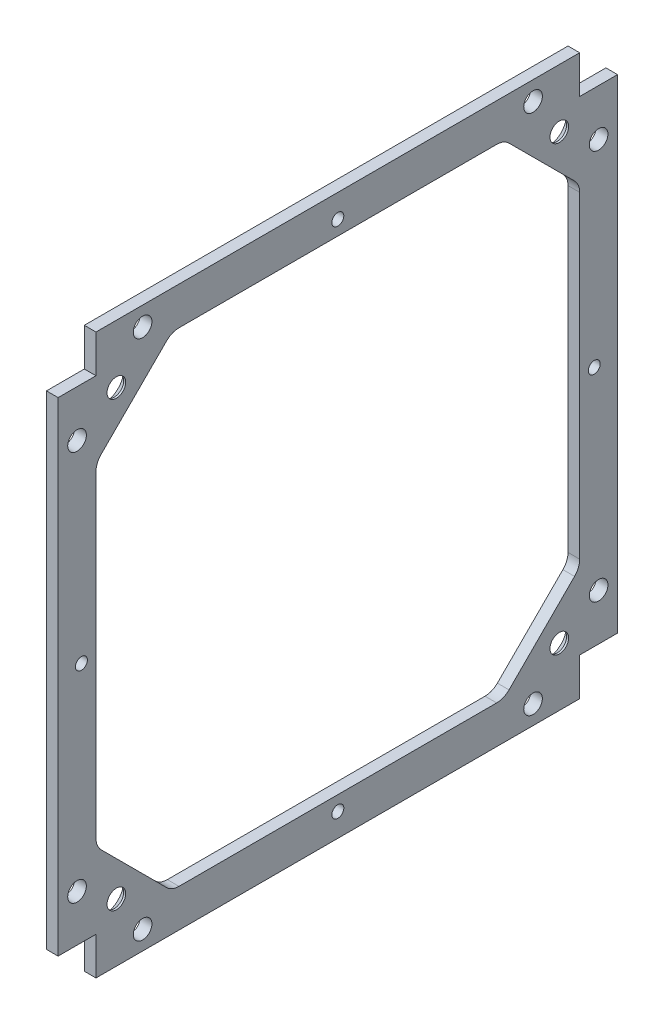
from build123d import *

# Parameters (mm, degrees)
BOSS_EXTRUDE2_DEPTH                          = 2
F_3_2_3_2_DIAMETER_HOLE3_D                   = 3.2
CSK_FOR_M3_FLAT_COUNTERSUNK_HEAD_SCR_2_COUNT = 2
CSK_FOR_M3_FLAT_COUNTERSUNK_HEAD_SCR_2_PITCH = 76
CSK_FOR_M3_FLAT_COUNTERSUNK_HEAD_SCR_3_COUNT = 2
CSK_FOR_M3_FLAT_COUNTERSUNK_HEAD_SCR_3_PITCH = 107.48023074
CSK_FOR_M3_FLAT_COUNTERSUNK_HEAD_SCR_4_COUNT = 2
CSK_FOR_M3_FLAT_COUNTERSUNK_HEAD_SCR_4_PITCH = 76
M2_5X0_45_TAPPED_HOLE1_D                     = 2.05
FILLET1_R                                    = 3


with BuildPart() as part:
    # Sketch2 → Boss-Extrude2 (new body)
    with BuildSketch(Plane.ZY.offset(51.493641502)):
        Polygon((0.93465612, 3.45185693), (7.43465612, 3.45185693), (7.43465612, 86.45185693), (0.93465612, 86.45185693), (0.93465612, 92.95185693), (-82.06534388, 92.95185693), (-82.06534388, 86.45185693), (-88.56534388, 86.45185693), (-88.56534388, 3.45185693), (-82.06534388, 3.45185693), (-82.06534388, -3.04814307), (0.93465612, -3.04814307), align=None)
        Polygon((-82.06534388, 73.45185693), (-82.06534388, 16.45185693), (-69.06534388, 3.45185693), (-12.06534388, 3.45185693), (0.93465612, 16.45185693), (0.93465612, 73.45185693), (-12.06534388, 86.45185693), (-69.06534388, 86.45185693), align=None, mode=Mode.SUBTRACT)
    extrude(amount=BOSS_EXTRUDE2_DEPTH)

    # Ø3.2 (3.2) Diameter Hole3 (through all)
    with Locations(Plane.ZY.offset(53.493641502)):
        with Locations((-74.06534388, 0.20185693), (-85.31534388, 11.45185693), (-85.31534388, 78.45185693), (-74.06534388, 89.70185693), (-7.06534388, 89.70185693), (4.18465612, 78.45185693), (4.18465612, 11.45185693), (-7.06534388, 0.20185693)):
            Hole(F_3_2_3_2_DIAMETER_HOLE3_D / 2)

    # Sketch24 → CSK for M3 Flat Countersunk Head Screw5 (revolve, cut)
    with BuildSketch(Plane(origin=(-53.493641502, 6.95185693, -78.56534388), x_dir=(0, 0, 1), z_dir=(0, 1, 0))):
        Polygon((0, 0), (0, 2), (1.6, 2), (1.6, 1.65), (3.25, 0), align=None)
    csk_for_m3_flat_countersunk_head_screw5 = revolve(axis=Axis((-59.843641502, 6.95185693, -78.56534388), (1, 0, 0)), mode=Mode.SUBTRACT)

    # CSK for M3 Flat Countersunk Head Scr 2: CSK for M3 Flat Countersunk Head Screw5 ×2
    with Locations(*[(0, i * CSK_FOR_M3_FLAT_COUNTERSUNK_HEAD_SCR_2_PITCH, 0) for i in range(1, CSK_FOR_M3_FLAT_COUNTERSUNK_HEAD_SCR_2_COUNT)]):
        add(csk_for_m3_flat_countersunk_head_screw5, mode=Mode.SUBTRACT)

    # CSK for M3 Flat Countersunk Head Scr 3: CSK for M3 Flat Countersunk Head Screw5 ×2
    with Locations(*[Vector(0, 0.7071067811865478, 0.7071067811865472) * (i * CSK_FOR_M3_FLAT_COUNTERSUNK_HEAD_SCR_3_PITCH) for i in range(1, CSK_FOR_M3_FLAT_COUNTERSUNK_HEAD_SCR_3_COUNT)]):
        add(csk_for_m3_flat_countersunk_head_screw5, mode=Mode.SUBTRACT)

    # CSK for M3 Flat Countersunk Head Scr 4: CSK for M3 Flat Countersunk Head Screw5 ×2
    with Locations(*[(0, 0, i * CSK_FOR_M3_FLAT_COUNTERSUNK_HEAD_SCR_4_PITCH) for i in range(1, CSK_FOR_M3_FLAT_COUNTERSUNK_HEAD_SCR_4_COUNT)]):
        add(csk_for_m3_flat_countersunk_head_screw5, mode=Mode.SUBTRACT)

    # M2.5x0.45 Tapped Hole1 (through all)
    with Locations(Plane(origin=(-53.493641502, 88.95185693, -40.56534388), x_dir=(0, 0, -1), z_dir=(-1, 0, 0))):
        with Locations((0, 0), (44, 44), (0, 88), (-44, 44)):
            Hole(M2_5X0_45_TAPPED_HOLE1_D / 2)

    # Fillet1
    fillet1_edges = [part.edges().sort_by_distance(p)[0] for p in [
        (-52.493641502, 86.45185693, -69.06534388),
        (-52.493641502, 73.45185693, -82.06534388),
        (-52.493641502, 16.45185693, -82.06534388),
        (-52.493641502, 3.45185693, -69.06534388),
        (-52.493641502, 3.45185693, -12.06534388),
        (-52.493641502, 16.45185693, 0.93465612),
        (-52.493641502, 73.45185693, 0.93465612),
        (-52.493641502, 86.45185693, -12.06534388),
    ]]
    fillet(fillet1_edges, radius=FILLET1_R)


solid = part.part
